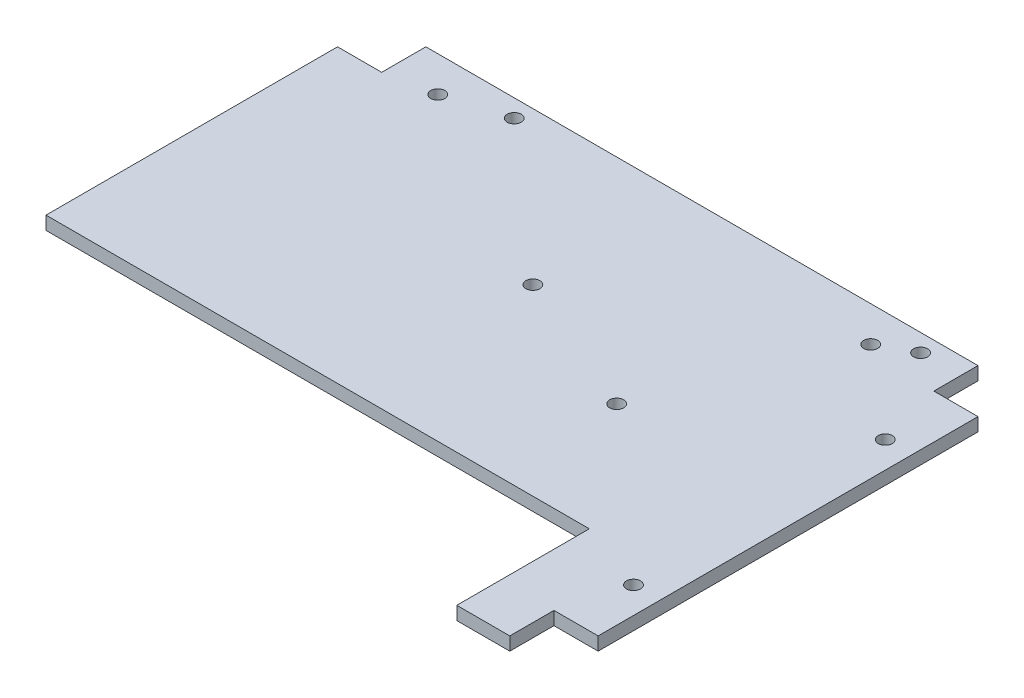
from build123d import *

# Parameters (mm, degrees)
EXTRUDE1_DEPTH     = 3
SKETCH2_R          = 1.5875
EXTRUDE2_DEPTH     = 3
SKETCH3_R          = 1.5875
EXTRUDE3_DEPTH     = 3
SKETCH5_R          = 1.5875
CUT_EXTRUDE1_DEPTH = 3


with BuildPart() as part:
    # Sketch1 → Extrude1 (new body)
    with BuildSketch(Plane(origin=(0, 0, 0), x_dir=(1, 0, 0), z_dir=(0, 1, 0))):
        Polygon((-145, -76), (-22, -76), (-22, -106), (-10, -106), (-10, -96), (0, -96), (0, -10), (-10, -10), (-10, 0), (-135, 0), (-135, -10), (-145, -10), align=None)
    extrude(amount=EXTRUDE1_DEPTH)

    # Sketch2 → Extrude2 (cut)
    with BuildSketch(Plane(origin=(0, 3, 0), x_dir=(1, 0, 0), z_dir=(0, 1, 0))):
        with Locations(Location((-6, -25, 0), (0, 0, 270))):
            Circle(SKETCH2_R)
        with Locations(Location((-6, -82, 0), (0, 0, 270))):
            Circle(SKETCH2_R)
        with Locations(Location((-26.3, -8, 0), (0, 0, 270))):
            Circle(SKETCH2_R)
        with Locations(Location((-124.3, -8, 0), (0, 0, 270))):
            Circle(SKETCH2_R)
    extrude(amount=-EXTRUDE2_DEPTH, mode=Mode.SUBTRACT)

    # Sketch3 → Extrude3 (cut)
    with BuildSketch(Plane(origin=(0, 3, 0), x_dir=(1, 0, 0), z_dir=(0, 1, 0))):
        with Locations(Location((-111, -4, 0), (0, 0, 270))):
            Circle(SKETCH3_R)
        with Locations(Location((-19, -4, 0), (0, 0, 270))):
            Circle(SKETCH3_R)
        with Locations(Location((-43.4, -48.4, 0), (0, 0, 270))):
            Circle(SKETCH3_R)
    extrude(amount=-EXTRUDE3_DEPTH, mode=Mode.SUBTRACT)

    # Sketch5 → Cut-Extrude1 (cut)
    with BuildSketch(Plane(origin=(0, 3, 0), x_dir=(1, 0, 0), z_dir=(0, 1, 0))):
        with Locations(Location((-76.25, -34.5240252, 0), (0, 0, 270))):
            Circle(SKETCH5_R)
    extrude(amount=-CUT_EXTRUDE1_DEPTH, mode=Mode.SUBTRACT)


solid = part.part
